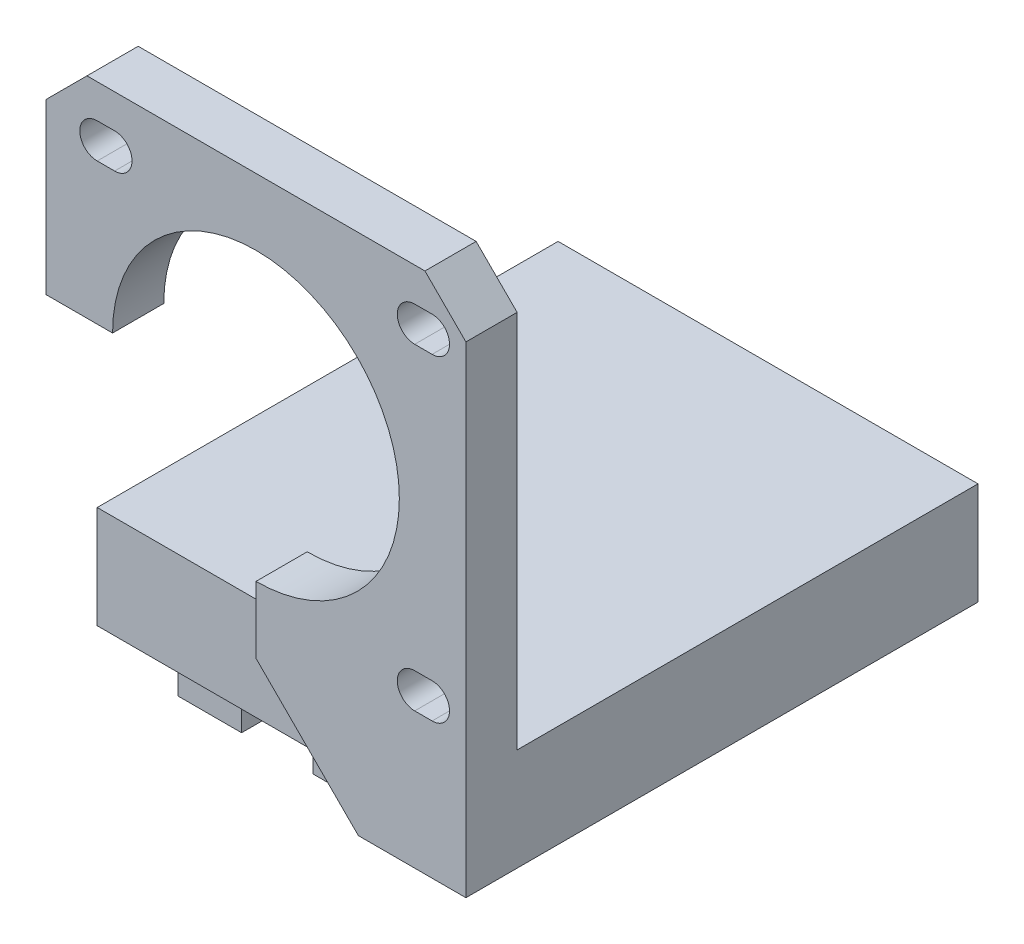
from build123d import *

# Parameters (mm, degrees)
SKETCH_1_R          = 11
SKETCH_1_R_2        = 1.7
EXTRUDE_1_DEPTH     = 5
EXTRUDE_2_DEPTH     = 4
SKETCH_3_W          = 41
SKETCH_3_H          = 10
EXTRUDE_3_DEPTH     = 45
EXTRUDE_4_DEPTH     = 5
CUT_EXTRUDE_1_DEPTH = 5
SKETCH_6_W          = 6.2
SKETCH_6_H          = 3
CUT_EXTRUDE_2_DEPTH = 5
SKETCH_8_R          = 11.5
CUT_EXTRUDE_3_DEPTH = 5
SKETCH_9_W          = 5
SKETCH_9_H          = 46
EXTRUDE_5_DEPTH     = 5
SKETCH_10_R         = 14
CUT_EXTRUDE_4_DEPTH = 5
SKETCH_11_W         = 20.5
SKETCH_11_H         = 30.5
CUT_EXTRUDE_5_DEPTH = 5
SKETCH_12_W         = 1
SKETCH_12_H         = 5
CUT_EXTRUDE_6_DEPTH = 20
CUT_EXTRUDE_7_DEPTH = 5
EXTRUDE_6_DEPTH     = 1
SKETCH_16_W         = 2
SKETCH_16_H         = 45
SKETCH_16_W_2       = 1.95
EXTRUDE_7_DEPTH     = 5
SKETCH_17_W         = 2
SKETCH_17_H         = 42
SKETCH_17_H_2       = 3
SKETCH_17_W_2       = 6.2
SKETCH_17_W_3       = 9.9
CUT_EXTRUDE_8_DEPTH = 5


with BuildPart() as part:
    # 草图1 → 凸台-拉伸1 (new body)
    with BuildSketch(Plane.XY):
        Polygon((-20.5, 0), (-20.5, -16.5), (-16.5, -20.5), (0, -20.5), (16.5, -20.5), (20.5, -16.5), (20.5, 0), (20.5, 16.5), (16.5, 20.5), (0, 20.5), (-16.5, 20.5), (-20.5, 16.5), align=None)
        Circle(SKETCH_1_R, mode=Mode.SUBTRACT)
        with Locations((15.5, -15.5)):
            Circle(SKETCH_1_R_2, mode=Mode.SUBTRACT)
        with Locations((15.5, 15.5)):
            Circle(SKETCH_1_R_2, mode=Mode.SUBTRACT)
        with Locations((-15.5, 15.5)):
            Circle(SKETCH_1_R_2, mode=Mode.SUBTRACT)
        with Locations((-15.5, -15.5)):
            Circle(SKETCH_1_R_2, mode=Mode.SUBTRACT)
    extrude(amount=EXTRUDE_1_DEPTH)

    # 草图2 → 凸台-拉伸2 (add)
    with BuildSketch(Plane(origin=(0, 0, 0), x_dir=(-1, 0, 0), z_dir=(0, 0, -1))):
        Polygon((-16.5, -30.5), (16.5, -30.5), (20.5, -30.5), (20.5, -16.5), (16.5, -20.5), (-16.5, -20.5), (-20.5, -16.5), (-20.5, -30.5), align=None)
    extrude(amount=-EXTRUDE_2_DEPTH)

    # 草图3 → 凸台-拉伸3 (add)
    with BuildSketch(Plane(origin=(0, 0, 0), x_dir=(-1, 0, 0), z_dir=(0, 0, -1))):
        with Locations((0, -25.5)):
            Rectangle(SKETCH_3_W, SKETCH_3_H)
    extrude(amount=EXTRUDE_3_DEPTH)

    # 草图4 → 凸台-拉伸4 (add)
    with BuildSketch(Plane.XZ.offset(30.5)):
        Polygon((-13.6, -2.908443575), (-13.6, 4), (-7.4, 4), (-7.4, -2.908443575), (-7.4, -45), (-13.6, -45), align=None)
    extrude(amount=EXTRUDE_4_DEPTH)

    # 草图5 → 切除-拉伸1 (cut)
    with BuildSketch(Plane.XY.offset(5)):
        with BuildLine():
            Line((15.5, 17.2), (15.5, 13.8))
            Line((15.5, 13.8), (17.2, 13.8))
            ThreePointArc((17.2, 13.8), (18.9, 15.5), (17.2, 17.2))
            Line((17.2, 17.2), (15.5, 17.2))
        make_face()
        with BuildLine():
            Line((15.5, -13.8), (15.5, -17.2))
            Line((15.5, -17.2), (17.2, -17.2))
            ThreePointArc((17.2, -17.2), (18.9, -15.5), (17.2, -13.8))
            Line((17.2, -13.8), (15.5, -13.8))
        make_face()
        with BuildLine():
            Line((-15.5, -13.8), (-15.5, -17.2))
            Line((-15.5, -17.2), (-13.8, -17.2))
            ThreePointArc((-13.8, -17.2), (-12.1, -15.5), (-13.8, -13.8))
            Line((-13.8, -13.8), (-15.5, -13.8))
        make_face()
        with BuildLine():
            Line((-15.5, 17.2), (-15.5, 13.8))
            Line((-15.5, 13.8), (-13.8, 13.8))
            ThreePointArc((-13.8, 13.8), (-12.1, 15.5), (-13.8, 17.2))
            Line((-13.8, 17.2), (-15.5, 17.2))
        make_face()
    extrude(amount=-CUT_EXTRUDE_1_DEPTH, mode=Mode.SUBTRACT)

    # 草图6 → 切除-拉伸2 (cut)
    with BuildSketch(Plane(origin=(0, -35.5, 0), x_dir=(-1, 0, 0), z_dir=(0, -1, 0))):
        with Locations((10.5, -2.5)):
            Rectangle(SKETCH_6_W, SKETCH_6_H)
    extrude(amount=-CUT_EXTRUDE_2_DEPTH, mode=Mode.SUBTRACT)

    # 草图8 → 切除-拉伸3 (cut)
    with BuildSketch(Plane.XY.offset(5)):
        Circle(SKETCH_8_R)
    extrude(amount=-CUT_EXTRUDE_3_DEPTH, mode=Mode.SUBTRACT)

    # 草图9 → 凸台-拉伸5 (add)
    with BuildSketch(Plane.XZ.offset(30.5)):
        with Locations((2, -22)):
            Rectangle(SKETCH_9_W, SKETCH_9_H)
    extrude(amount=EXTRUDE_5_DEPTH)

    # 草图10 → 切除-拉伸4 (cut)
    with BuildSketch(Plane.XY.offset(5)):
        Circle(SKETCH_10_R)
    extrude(amount=-CUT_EXTRUDE_4_DEPTH, mode=Mode.SUBTRACT)

    # 草图11 → 切除-拉伸5 (cut)
    with BuildSketch(Plane.XY.offset(5)):
        with Locations((-10.25, -15.25)):
            Rectangle(SKETCH_11_W, SKETCH_11_H)
    extrude(amount=-CUT_EXTRUDE_5_DEPTH, mode=Mode.SUBTRACT)

    # 草图12 → 切除-拉伸6 (cut)
    with BuildSketch(Plane.ZY.offset(13.6)):
        with Locations((0.5, -33)):
            Rectangle(SKETCH_12_W, SKETCH_12_H)
    extrude(amount=-CUT_EXTRUDE_6_DEPTH, mode=Mode.SUBTRACT)

    # 草图14 → 切除-拉伸7 (cut)
    with BuildSketch(Plane.XY.offset(5)):
        Polygon((0, -20.5), (10, -30.5), (0, -30.5), align=None)
    extrude(amount=-CUT_EXTRUDE_7_DEPTH, mode=Mode.SUBTRACT)

    # 草图15 → 凸台-拉伸6 (add)
    with BuildSketch(Plane.XY.offset(4)):
        Polygon((0, -20.5), (10, -30.5), (20.5, -30.5), (20.5, -16.5), (16.5, -20.5), align=None)
    extrude(amount=EXTRUDE_6_DEPTH)

    # 草图16 → 凸台-拉伸7 (add)
    with BuildSketch(Plane.XZ.offset(35.5)):
        with Locations((-14.6, -22.5)):
            Rectangle(SKETCH_16_W, SKETCH_16_H)
        with Locations((-1.475, -22.5)):
            Rectangle(SKETCH_16_W_2, SKETCH_16_H)
    extrude(amount=-EXTRUDE_7_DEPTH)

    # 草图17 → 切除-拉伸8 (cut)
    with BuildSketch(Plane.XZ.offset(35.5)):
        with Locations((-8.4, -24)):
            Rectangle(SKETCH_17_W, SKETCH_17_H)
        with Locations((-8.4, -1.5)):
            Rectangle(SKETCH_17_W, SKETCH_17_H_2)
        with Locations((-12.5, -1.5)):
            Rectangle(SKETCH_17_W_2, SKETCH_17_H_2)
        with Locations((-2.45, -1.5)):
            Rectangle(SKETCH_17_W_3, SKETCH_17_H_2)
        with Locations((3.5, -1.5)):
            Rectangle(SKETCH_17_W, SKETCH_17_H_2)
        with Locations((3.5, -24)):
            Rectangle(SKETCH_17_W, SKETCH_17_H)
    extrude(amount=-CUT_EXTRUDE_8_DEPTH, mode=Mode.SUBTRACT)


solid = part.part
